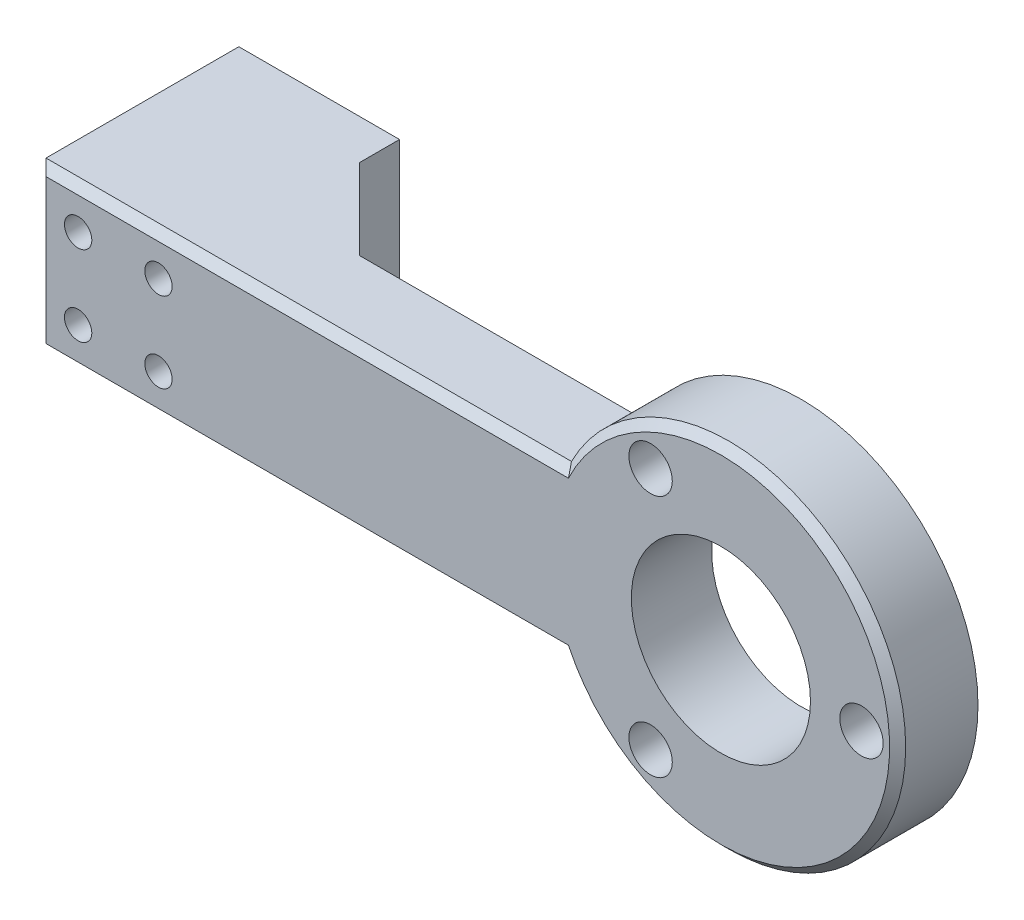
from build123d import *
from build123d.topology import SkipClean

# Parameters (mm, degrees)
SKETCH_1_R          = 22
SKETCH_1_R_2        = 11.15
SKETCH_1_R_3        = 2.7
EXTRUDE_1_DEPTH     = 10
EXTRUDE_START       = -10
EXTRUDE_2_DEPTH     = 10
CUT_EXTRUDE_START   = -10
CUT_EXTRUDE_1_DEPTH = 10
SKETCH_4_W          = 20
SKETCH_4_H          = 20
EXTRUDE_3_DEPTH     = 15
CHAMFER_2_SIZE      = 10
CHAMFER_4_SIZE      = 1
SKETCH_6_R          = 1.7
CUT_EXTRUDE_3_DEPTH = 92.290744328
CHAMFER_6_SIZE      = 1


with BuildPart() as part:
    # ｽｹｯﾁ1 → ﾎﾞｽ - 押し出し1 (new body)
    with BuildSketch(Plane.XY):
        Circle(SKETCH_1_R)
        Circle(SKETCH_1_R_2, mode=Mode.SUBTRACT)
        with Locations((-8.75, -15.155444566)):
            Circle(SKETCH_1_R_3, mode=Mode.SUBTRACT)
        with Locations((17.5, 0)):
            Circle(SKETCH_1_R_3, mode=Mode.SUBTRACT)
        with Locations((-8.75, 15.155444566)):
            Circle(SKETCH_1_R_3, mode=Mode.SUBTRACT)
    extrude(amount=EXTRUDE_1_DEPTH)

    # ｽｹｯﾁ2 → ﾎﾞｽ - 押し出し2 (add)
    with BuildSketch(Plane.XY.offset(10).offset(EXTRUDE_START)):
        with BuildLine():
            ThreePointArc((0, -22), (-22, 0), (0, 22))
            Line((0, 22), (-85, 22))
            Line((-85, 22), (-85, -22))
            Line((-85, -22), (0, -22))
        make_face()
    extrude(amount=EXTRUDE_2_DEPTH)

    # ｽｹｯﾁ3 → ｶｯﾄ - 押し出し1 (cut)
    with BuildSketch(Plane.XY.offset(10).offset(CUT_EXTRUDE_START)):
        with BuildLine():
            Line((-85, 22), (-85, 10))
            Line((-85, 10), (-19.595917942, 10))
            ThreePointArc((-19.595917942, 10), (-11.489125293, 18.761663039), (0, 22))
            Line((0, 22), (-85, 22))
        make_face()
        with BuildLine():
            Line((-19.595917942, -10), (-85, -10))
            Line((-85, -10), (-85, -22))
            Line((-85, -22), (0, -22))
            ThreePointArc((0, -22), (-11.489125293, -18.761663039), (-19.595917942, -10))
        make_face()
    extrude(amount=CUT_EXTRUDE_1_DEPTH, mode=Mode.SUBTRACT)

    # ｽｹｯﾁ4 → ﾎﾞｽ - 押し出し3 (add)
    with BuildSketch(Plane(origin=(0, 0, 0), x_dir=(-1, 0, 0), z_dir=(0, 0, -1))):
        with Locations((75, 0)):
            Rectangle(SKETCH_4_W, SKETCH_4_H)
    extrude(amount=EXTRUDE_3_DEPTH)

    # 面取り2
    chamfer_2_edges = [part.edges().sort_by_distance(p)[0] for p in [
        (-65, 0, 0),
    ]]
    chamfer(chamfer_2_edges, length=CHAMFER_2_SIZE)

    # 面取り4
    chamfer_4_edges = [part.edges().sort_by_distance(p)[0] for p in [
        (22, 0, 10),
        (-52.297958971, 10, 10),
        (-52.297958971, -10, 10),
    ]]
    chamfer(chamfer_4_edges, length=CHAMFER_4_SIZE)

    # ｽｹｯﾁ6 → ｶｯﾄ - 押し出し3 (cut, through all)
    with SkipClean():  # the faces are left unmerged after this step: merging them gives an invalid solid
        with BuildSketch(Plane(origin=(0, 0, -15), x_dir=(-1, 0, 0), z_dir=(0, 0, -1))):
            with Locations((80, 5)):
                Circle(SKETCH_6_R)
            with Locations(Location((70, 5, 0), (0, 0, 180))):
                Circle(SKETCH_6_R)
            with Locations((70, -5)):
                Circle(SKETCH_6_R)
            with Locations(Location((80, -5, 0), (0, 0, 180))):
                Circle(SKETCH_6_R)
        extrude(amount=-CUT_EXTRUDE_3_DEPTH, mode=Mode.SUBTRACT)

    # 面取り6
    chamfer_6_edges = [part.edges().sort_by_distance(p)[0] for p in [
        (-85, 0, 10),
    ]]
    chamfer(chamfer_6_edges, length=CHAMFER_6_SIZE)


solid = part.part
